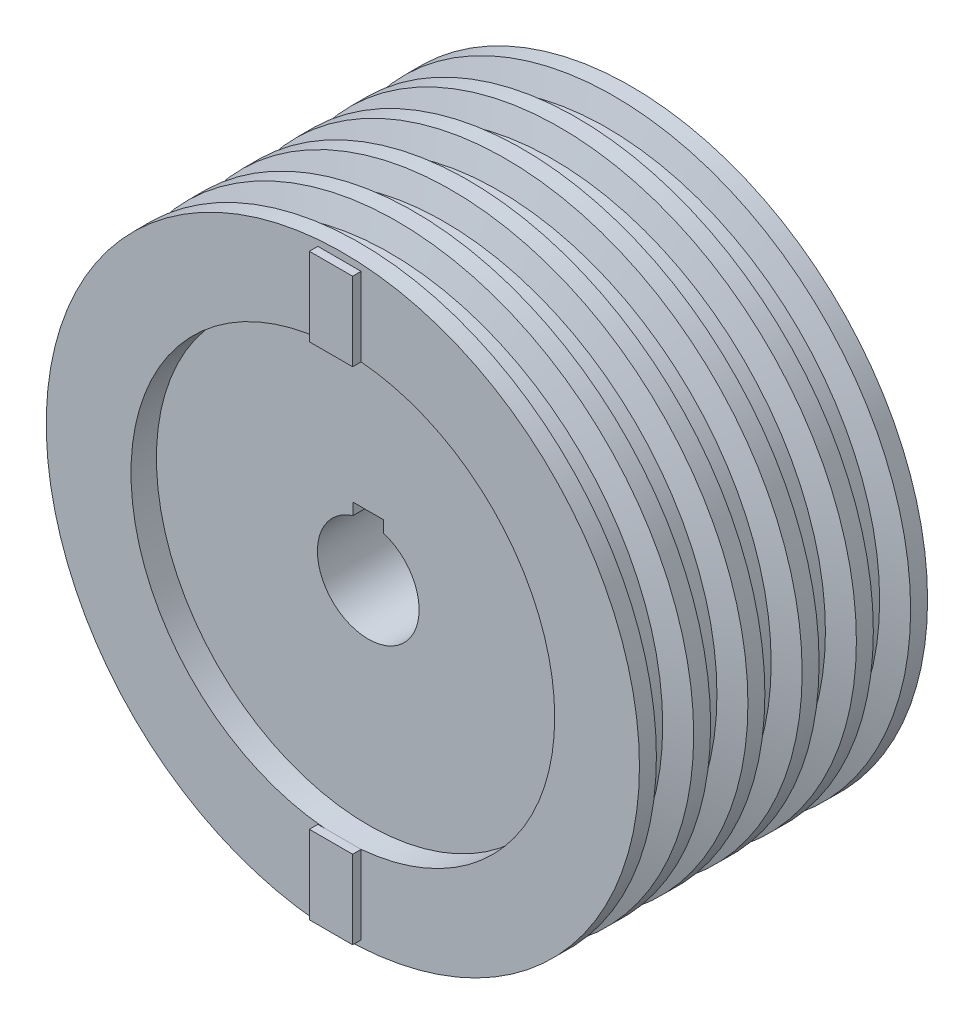
from build123d import *

# Parameters (mm, degrees)
SKETCH1_R           = 175
BOSS_EXTRUDE1_DEPTH = 85
SKETCH3_R           = 30
CUT_EXTRUDE1_DEPTH  = 301.24989592
SKETCH4_R           = 125
SKETCH4_R_2         = 30
CUT_EXTRUDE2_DEPTH  = 15
SKETCH5_W           = 18
SKETCH5_H           = 11
CUT_EXTRUDE3_DEPTH  = 293.018835009
SKETCH10_W          = 25.511557439
SKETCH10_H          = 46.274630521
BOSS_EXTRUDE2_DEPTH = 5


with BuildPart() as part:
    # Sketch1 → Boss-Extrude1 (new, symmetric)
    with BuildSketch(Plane.XY):
        Circle(SKETCH1_R)
    extrude(amount=BOSS_EXTRUDE1_DEPTH, both=True)

    # Sketch3 → Cut-Extrude1 (cut, through all)
    with BuildSketch(Plane.XY.offset(85)):
        Circle(SKETCH3_R)
    extrude(amount=-CUT_EXTRUDE1_DEPTH, mode=Mode.SUBTRACT)

    # Sketch4 → Cut-Extrude2 (cut)
    with BuildSketch(Plane.XY.offset(85)):
        Circle(SKETCH4_R)
        Circle(SKETCH4_R_2, mode=Mode.SUBTRACT)
    cut_extrude2 = extrude(amount=-CUT_EXTRUDE2_DEPTH, mode=Mode.SUBTRACT)

    # Mirror1: Cut-Extrude2 across plane
    add(cut_extrude2.mirror(Plane.XY), mode=Mode.SUBTRACT)

    # Sketch5 → Cut-Extrude3 (cut, through all)
    with BuildSketch(Plane.XY.offset(70)):
        with Locations((0, 30)):
            Rectangle(SKETCH5_W, SKETCH5_H)
    extrude(amount=-CUT_EXTRUDE3_DEPTH, mode=Mode.SUBTRACT)

    # Sketch9 → Cut-Revolve2 (revolve, cut)
    with BuildSketch(Plane(origin=(0, 0, 0), x_dir=(1, 0, 0), z_dir=(0, 1, 0))):
        Polygon((175, 75), (161, 70.71977046), (161, 57.28022954), (175, 53), align=None)
        Polygon((175, 43), (175, 21), (161, 25.28022954), (161, 38.71977046), align=None)
        Polygon((175, 11), (161, 6.71977046), (161, -6.71977046), (175, -11), align=None)
        Polygon((175, -21), (175, -43), (161, -38.71977046), (161, -25.28022954), align=None)
        Polygon((175, -53), (161, -57.28022954), (161, -70.71977046), (175, -75), align=None)
    revolve(axis=Axis((0, 0, 0), (0, 0, -1)), mode=Mode.SUBTRACT)

    # Sketch10 → Boss-Extrude2 (add)
    with BuildSketch(Plane.XY.offset(85)):
        with Locations((-1.990425285, 147.672881125)):
            Rectangle(SKETCH10_W, SKETCH10_H)
        with Locations((-1.990425285, -147.672881125)):
            Rectangle(SKETCH10_W, SKETCH10_H)
    extrude(amount=BOSS_EXTRUDE2_DEPTH)


solid = part.part
